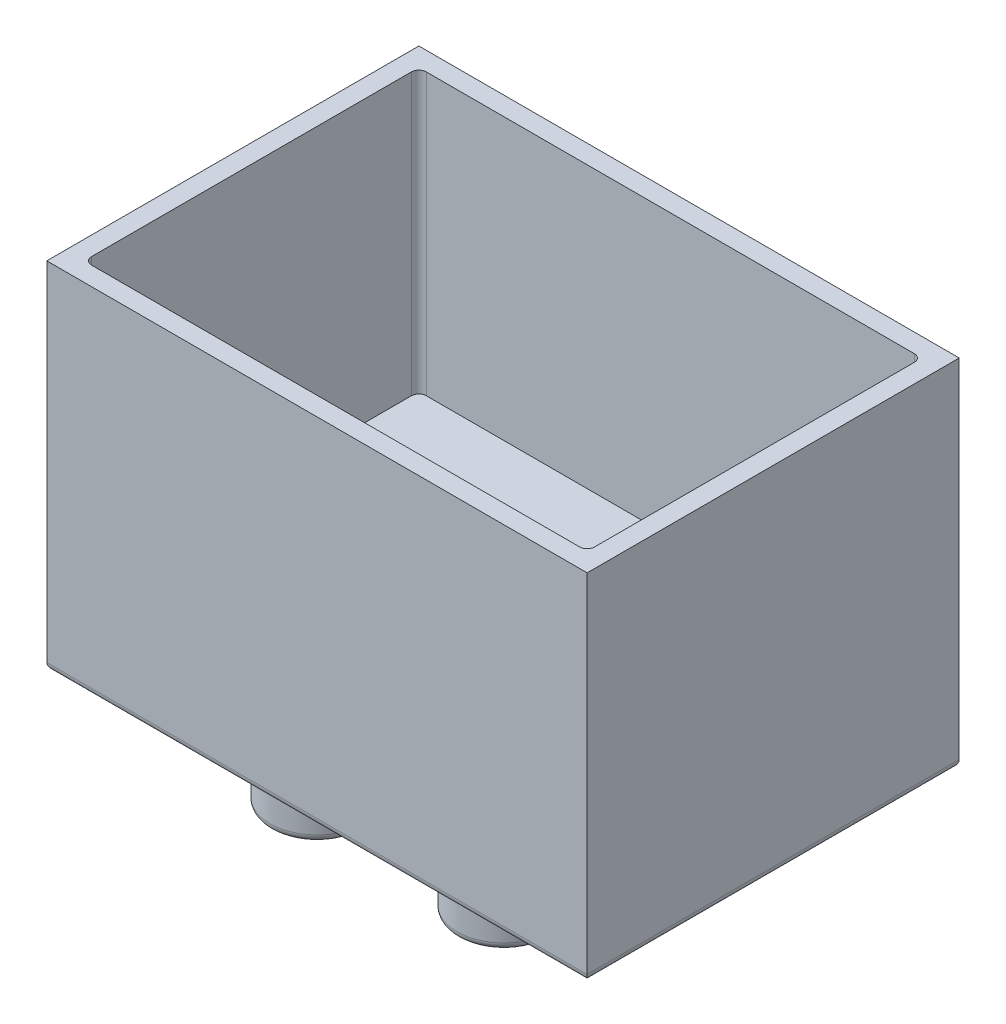
from build123d import *

# Parameters (mm, degrees)
SKETCH1_W           = 28.9
SKETCH1_H           = 19.9
SKETCH1_W_2         = 26.9
SKETCH1_H_2         = 17.9
BOSS_EXTRUDE1_DEPTH = 15
SKETCH1_3_W         = 28.9
SKETCH1_3_H         = 19.9
BOSS_EXTRUDE2_DEPTH = 4
SKETCH2_R           = 2.5
BOSS_EXTRUDE3_DEPTH = 4
FILLET1_R           = 0.4
FILLET2_R           = 0.4


with BuildPart() as part:
    # Sketch1 → Boss-Extrude1 (new body)
    with BuildSketch(Plane(origin=(0, 0, 0), x_dir=(1, 0, 0), z_dir=(0, 1, 0))):
        with Locations((13.25, 8.75)):
            Rectangle(SKETCH1_W, SKETCH1_H)
        with Locations((13.25, 8.75)):
            Rectangle(SKETCH1_W_2, SKETCH1_H_2, mode=Mode.SUBTRACT)
    extrude(amount=BOSS_EXTRUDE1_DEPTH)

    # Sketch1<3> → Boss-Extrude2 (add)
    with BuildSketch(Plane(origin=(0, 0, 0), x_dir=(1, 0, 0), z_dir=(0, 1, 0))):
        with Locations((13.25, 8.75)):
            Rectangle(SKETCH1_3_W, SKETCH1_3_H)
    extrude(amount=-BOSS_EXTRUDE2_DEPTH)

    # Sketch2 → Boss-Extrude3 (add)
    with BuildSketch(Plane.XZ.offset(4)):
        with Locations((8.25, -3.8)):
            Circle(SKETCH2_R)
        with Locations((18.25, -3.8)):
            Circle(SKETCH2_R)
    extrude(amount=BOSS_EXTRUDE3_DEPTH)

    # Fillet1
    fillet1_edges = [part.edges().sort_by_distance(p)[0] for p in [
        (13.25, -4, 1.2),
        (27.7, -4, -8.75),
        (13.25, -4, -18.7),
        (-1.2, -4, -8.75),
        (5.75, -4, -3.8),
        (15.75, -4, -3.8),
        (15.75, -8, -3.8),
        (5.75, -8, -3.8),
    ]]
    fillet(fillet1_edges, radius=FILLET1_R)

    # Fillet2
    fillet2_edges = [part.edges().sort_by_distance(p)[0] for p in [
        (26.7, 7.5, 0.2),
        (26.7, 7.5, -17.7),
        (-0.2, 7.5, 0.2),
        (-0.2, 7.5, -17.7),
    ]]
    fillet(fillet2_edges, radius=FILLET2_R)


solid = part.part
